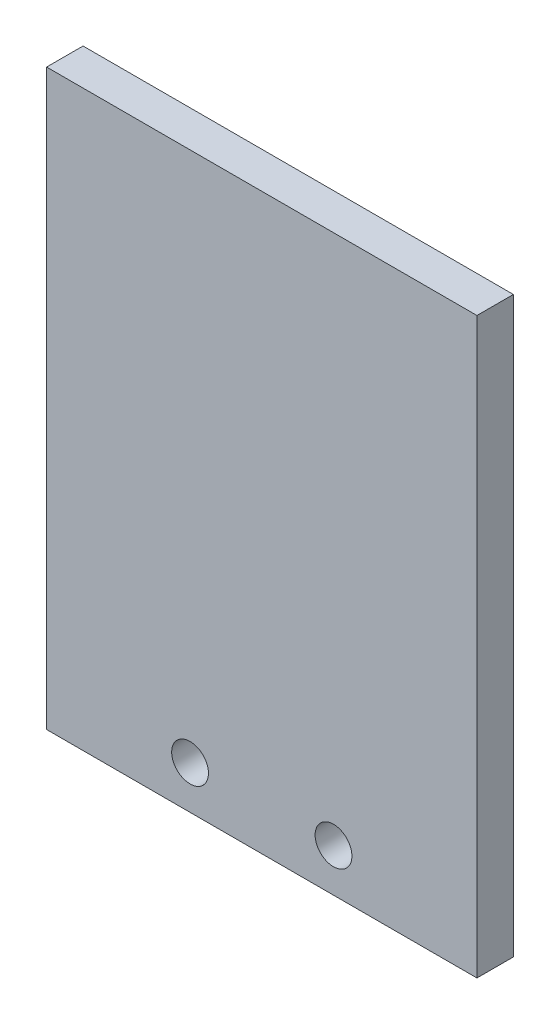
from build123d import *

# Parameters (mm, degrees)
SKETCH1_W                  = 150
SKETCH1_H                  = 200
BOSS_EXTRUDE1_DEPTH        = 12.7
F_1_2_0_5_DIAMETER_HOLE1_D = 12.827


with BuildPart() as part:
    # Sketch1 → Boss-Extrude1 (new body)
    with BuildSketch(Plane.XY):
        with Locations((75, 100)):
            Rectangle(SKETCH1_W, SKETCH1_H)
    extrude(amount=BOSS_EXTRUDE1_DEPTH)

    # 1/2 (0.5) Diameter Hole1 (through all)
    with Locations(Plane.XY.offset(12.7)):
        with Locations((100, 15), (50, 15)):
            Hole(F_1_2_0_5_DIAMETER_HOLE1_D / 2)


solid = part.part
